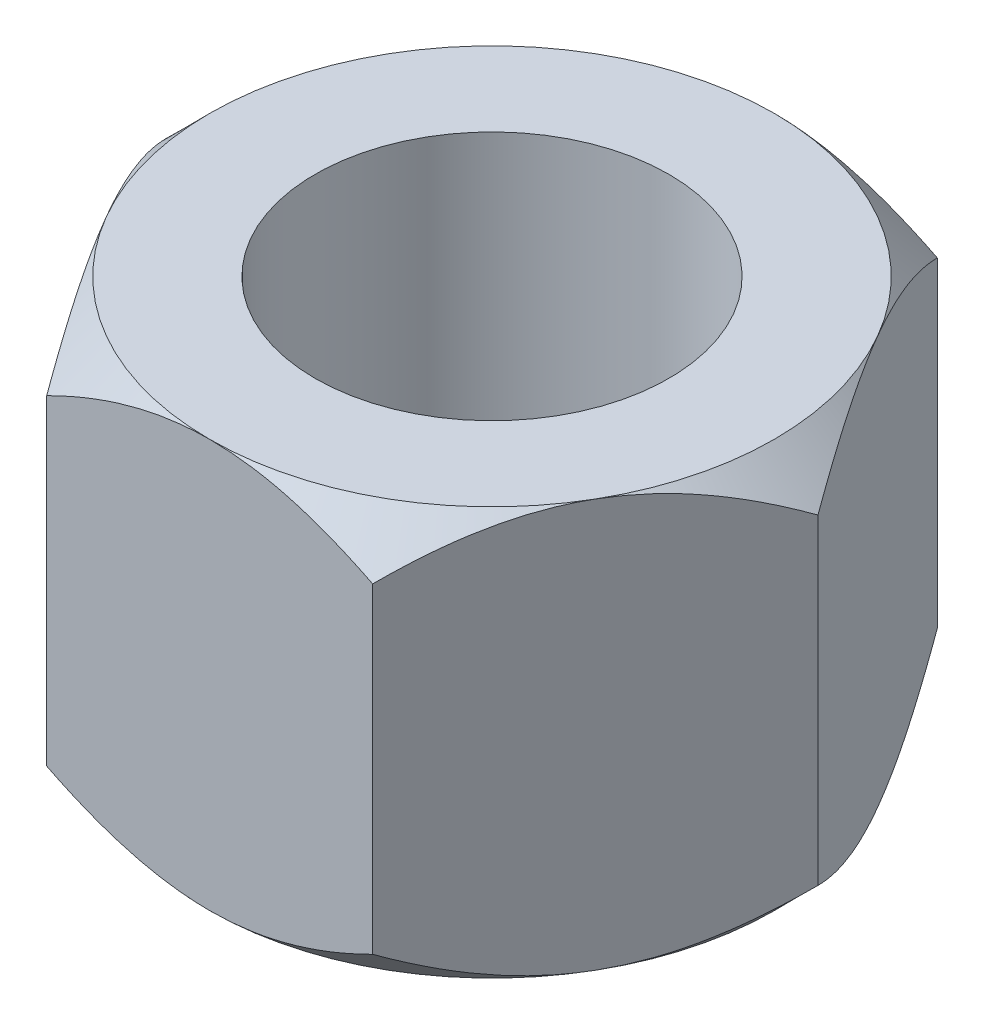
from build123d import *

# Parameters (mm, degrees)
BOSS_EXTRUDE1_DEPTH          = 30
CUT_EXTRUDE1_DEPTH           = 88.284496523
CUT_EXTRUDE1_DEPTH_BACK      = 88.284496523
SKETCH2_R                    = 26
SKETCH3_OUTSIDE_W            = 302.462
SKETCH3_OUTSIDE_H            = 289.622
SKETCH3_OUTSIDE_R            = 41.5
CUT_EXTRUDE2_DEPTH           = 88.284496523
CUT_EXTRUDE2_TAPER           = 45
CUT_EXTRUDE2_OTHER_WAY_DEPTH = 88.284496523


with BuildPart() as part:
    # Sketch1 → Boss-Extrude1 (new, symmetric)
    with BuildSketch(Plane(origin=(0, 0, 0), x_dir=(-1, 0, 0), z_dir=(0, 1, 0))):
        Polygon((47.920072343, 0), (23.960036171, 41.5), (-23.960036171, 41.5), (-47.920072343, 0), (-23.960036171, -41.5), (23.960036171, -41.5), align=None)
    extrude(amount=BOSS_EXTRUDE1_DEPTH, both=True)

    # Sketch2 → Cut-Extrude1 (cut, two sides: drawn at the far end of the back side and taken through both)
    with BuildSketch(Plane(origin=(0, 30, 0), x_dir=(-1, 0, 0), z_dir=(0, 1, 0)).offset(-CUT_EXTRUDE1_DEPTH_BACK)):
        with Locations(Location((0, 0, 0), (0, 0, 90))):
            Circle(SKETCH2_R)
    extrude(amount=CUT_EXTRUDE1_DEPTH + CUT_EXTRUDE1_DEPTH_BACK, mode=Mode.SUBTRACT)

    # Sketch3 outside → Cut-Extrude2 (cut)
    with BuildSketch(Plane(origin=(0, 30, 0), x_dir=(-1, 0, 0), z_dir=(0, 1, 0))):
        Rectangle(SKETCH3_OUTSIDE_W, SKETCH3_OUTSIDE_H)
        Circle(SKETCH3_OUTSIDE_R, mode=Mode.SUBTRACT)
    cut_extrude2 = extrude(amount=-CUT_EXTRUDE2_DEPTH, taper=CUT_EXTRUDE2_TAPER, mode=Mode.SUBTRACT)

    # Sketch3 outside → Cut-Extrude2 other way (cut)
    with BuildSketch(Plane(origin=(0, 30, 0), x_dir=(-1, 0, 0), z_dir=(0, 1, 0))):
        Rectangle(SKETCH3_OUTSIDE_W, SKETCH3_OUTSIDE_H)
        Circle(SKETCH3_OUTSIDE_R, mode=Mode.SUBTRACT)
    extrude(amount=CUT_EXTRUDE2_OTHER_WAY_DEPTH, mode=Mode.SUBTRACT)

    # Mirror1: Cut-Extrude2 across plane
    add(cut_extrude2.mirror(Plane.ZX), mode=Mode.SUBTRACT)


solid = part.part
